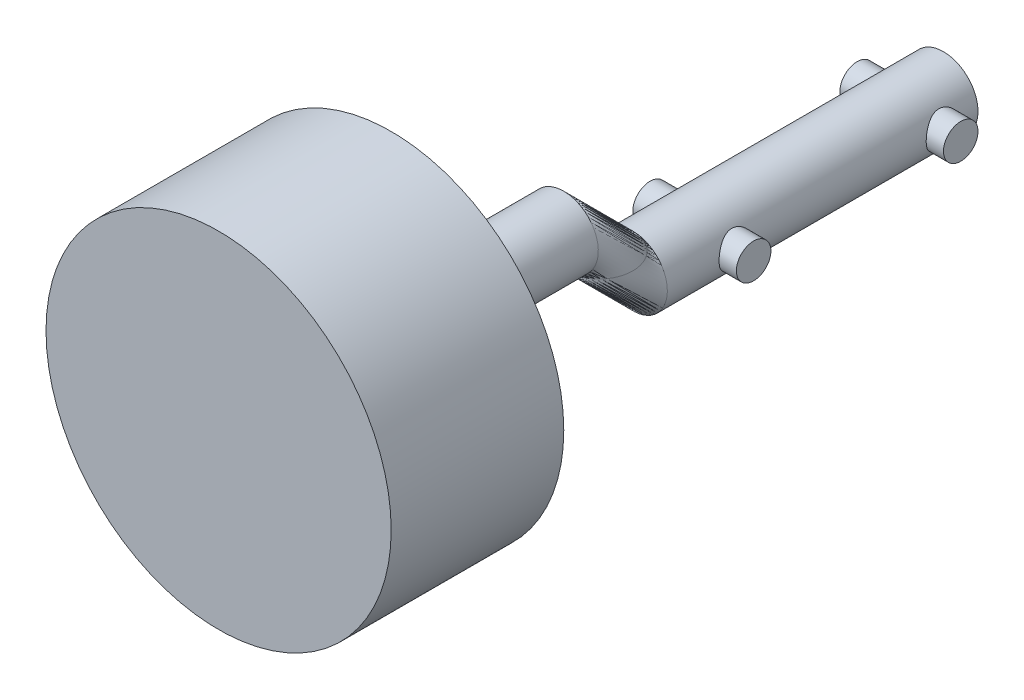
from build123d import *

# Parameters (mm, degrees)
ESQUISSE1_R             = 10
BOSS_EXTRU_1_DEPTH      = 10
ESQUISSE2_R             = 2
BOSS_EXTRU_2_DEPTH      = 3
BOSS_EXTRU_2_DEPTH_BACK = 3
ESQUISSE4_R             = 1


with BuildPart() as part:
    # Esquisse1 → Boss.-Extru.1 (new body)
    with BuildSketch(Plane.XY):
        Circle(ESQUISSE1_R)
    extrude(amount=BOSS_EXTRU_1_DEPTH)

    # Balayage1: sweep along a path in Esquisse3
    with BuildLine(Plane(origin=(0, 0, 0), x_dir=(0, 0, -1), z_dir=(1, 0, 0))) as balayage1_path:
        Line((0, 0), (10, 0))
        ThreePointArc((10, 0), (11.414213562, -0.585786438), (12, -2))
        ThreePointArc((12, -2), (12.585786438, -3.414213562), (14, -4))
        Line((14, -4), (32, -4))
    # Esquisse2 → Balayage1 (sweep)
    with BuildSketch(Plane(origin=(0, 0, 0), x_dir=(-1, 0, 0), z_dir=(0, 0, -1))):
        Circle(ESQUISSE2_R)
    sweep(path=balayage1_path.line)

    # Esquisse4 → Boss.-Extru.2 (add, two sides: drawn at the far end of the back side and taken through both)
    with BuildSketch(Plane(origin=(0, 0, 0), x_dir=(0, 0, -1), z_dir=(1, 0, 0)).offset(-BOSS_EXTRU_2_DEPTH_BACK)):
        with Locations((18, -4)):
            Circle(ESQUISSE4_R)
        with Locations((30, -4)):
            Circle(ESQUISSE4_R)
    extrude(amount=BOSS_EXTRU_2_DEPTH + BOSS_EXTRU_2_DEPTH_BACK)


solid = part.part
